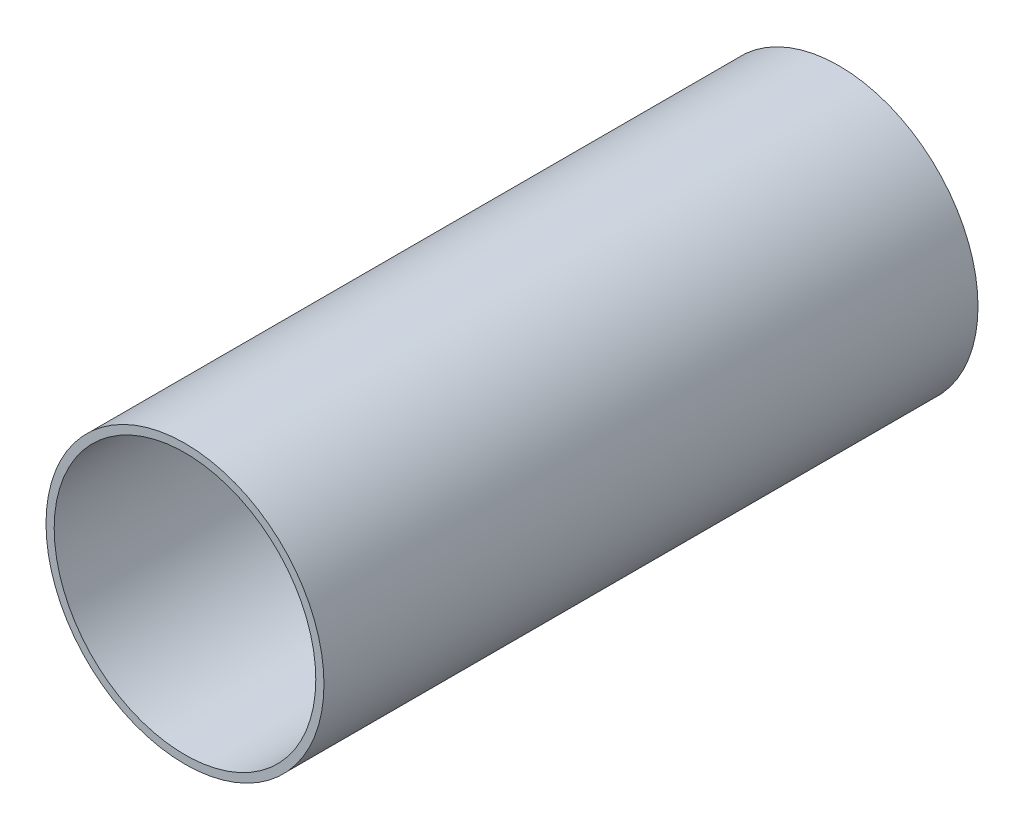
from build123d import *

# Parameters (mm, degrees)
SKETCH1_W = 20
SKETCH1_H = 0.25


with BuildPart() as part:
    # Sketch1 → Revolve1 (revolve)
    with BuildSketch(Plane(origin=(0, 0, 0), x_dir=(0, 0, -1), z_dir=(1, 0, 0)), mode=Mode.PRIVATE) as revolve1_sk:
        with Locations((10, 4.125)):
            Rectangle(SKETCH1_W, SKETCH1_H)
    revolve(revolve1_sk.sketch.rotate(Axis((0, 0, 0), (0, 0, -1)), 90), axis=Axis((0, 0, 0), (0, 0, -1)))


solid = part.part
